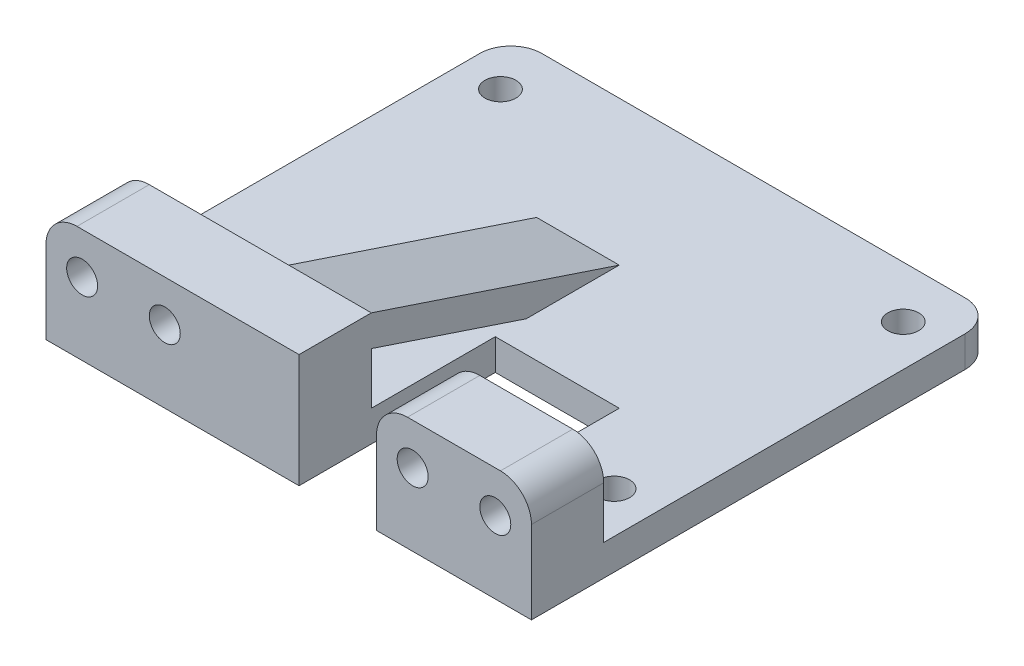
from build123d import *

# Parameters (mm, degrees)
SKETCH_1_R      = 1.5
EXTRUDE_1_DEPTH = 3
SKETCH_2_W      = 23.5
SKETCH_2_H      = 11
SKETCH_2_R      = 1.5
SKETCH_2_W_2    = 1
SKETCH_2_W_3    = 15
EXTRUDE_2_DEPTH = 7
FILLET_2_R      = 3
EXTRUDE_3_DEPTH = 8
FILLET_3_R      = 3
FILLET_4_R      = 3


with BuildPart() as part:
    # 草图1 → 凸台-拉伸1 (new body)
    with BuildSketch(Plane(origin=(0, 0, 0), x_dir=(1, 0, 0), z_dir=(0, 1, 0))):
        Polygon((-23.5, 19), (-23.5, -19), (1, -19), (1, -7), (13, -7), (13, -19), (23.5, -19), (23.5, 19), align=None)
        with Locations(Location((-19.5, -14, 0), (0, 0, 270))):
            Circle(SKETCH_1_R, mode=Mode.SUBTRACT)
        with Locations(Location((19.5, -14, 0), (0, 0, 270))):
            Circle(SKETCH_1_R, mode=Mode.SUBTRACT)
        with Locations(Location((-19.5, 14, 0), (0, 0, 270))):
            Circle(SKETCH_1_R, mode=Mode.SUBTRACT)
        with Locations(Location((19.5, 14, 0), (0, 0, 270))):
            Circle(SKETCH_1_R, mode=Mode.SUBTRACT)
    extrude(amount=EXTRUDE_1_DEPTH)

    # 草图2 → 凸台-拉伸2 (add)
    # profile 1 of 3: a face of its own
    with BuildSketch(Plane.XY.offset(19)):
        with Locations((-11.75, 5.5)):
            Rectangle(SKETCH_2_W, SKETCH_2_H)
        with Locations((-20, 7)):
            Circle(SKETCH_2_R, mode=Mode.SUBTRACT)
        with Locations((-12, 7)):
            Circle(SKETCH_2_R, mode=Mode.SUBTRACT)
    # profile 2 of 3: a face of its own
    with BuildSketch(Plane.XY.offset(19)):
        with Locations((0.5, 5.5)):
            Rectangle(SKETCH_2_W_2, SKETCH_2_H)
    # profile 3 of 3: a face of its own
    with BuildSketch(Plane.XY.offset(19)):
        with Locations((16, 5.5)):
            Rectangle(SKETCH_2_W_3, SKETCH_2_H)
        with Locations((12, 7)):
            Circle(SKETCH_2_R, mode=Mode.SUBTRACT)
        with Locations((20, 7)):
            Circle(SKETCH_2_R, mode=Mode.SUBTRACT)
    extrude(amount=EXTRUDE_2_DEPTH)

    # 圆角2
    fillet_2_edges = [part.edges().sort_by_distance(p)[0] for p in [
        (-23.5, 1.5, -19),
        (23.5, 1.5, -19),
    ]]
    fillet(fillet_2_edges, radius=FILLET_2_R)

    # 草图3 → 凸台-拉伸3 (add)
    with BuildSketch(Plane(origin=(1, 0, 0), x_dir=(0, 0, -1), z_dir=(1, 0, 0))):
        Polygon((-19, 11), (-19, 8), (-4, 3), (5, 3), align=None)
    extrude(amount=-EXTRUDE_3_DEPTH)

    # 圆角3
    fillet_3_edges = [part.edges().sort_by_distance(p)[0] for p in [
        (13, 1.5, 19),
    ]]
    fillet(fillet_3_edges, radius=FILLET_3_R)

    # 圆角4
    fillet_4_edges = [part.edges().sort_by_distance(p)[0] for p in [
        (-23.5, 11, 22.5),
        (23.5, 11, 22.5),
        (8.5, 11, 22.5),
    ]]
    fillet(fillet_4_edges, radius=FILLET_4_R)


solid = part.part
